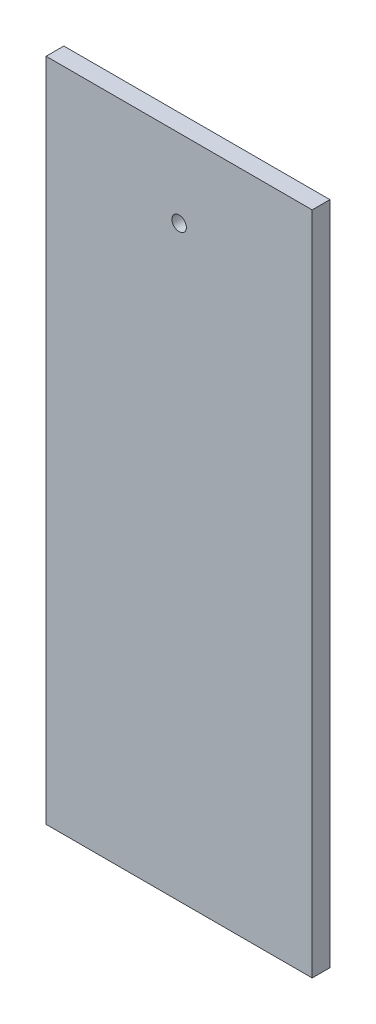
from build123d import *

# Parameters (mm, degrees)
SKETCH1_W           = 30
SKETCH1_H           = 75
SKETCH1_R           = 0.815
BOSS_EXTRUDE1_DEPTH = 2


with BuildPart() as part:
    # Sketch1 → Boss-Extrude1 (new body)
    with BuildSketch(Plane.XY):
        with Locations((15, 37.5)):
            Rectangle(SKETCH1_W, SKETCH1_H)
        with Locations((15, 66.185)):
            Circle(SKETCH1_R, mode=Mode.SUBTRACT)
    extrude(amount=BOSS_EXTRUDE1_DEPTH)


solid = part.part
